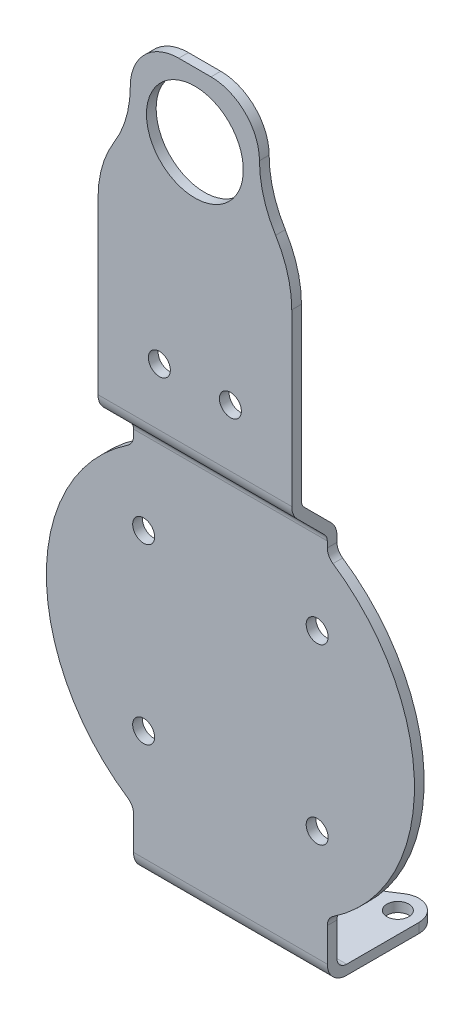
from build123d import *

# Parameters (mm, degrees)
EXTRUDE_1_DEPTH             = 30
EXTRUDE_2_DEPTH             = 14.177345132
SKETCH_3_W                  = 30
SKETCH_3_H                  = 14.177345132
EXTRUDE_3_DEPTH             = 7.766758368
EXTRUDE_4_DEPTH             = 1.5
CUT_EXTRUDE_START           = -0.577345132
CUT_EXTRUDE_1_DEPTH         = 0.577345132
CUT_EXTRUDE_START_2         = -12.1
CUT_EXTRUDE_2_DEPTH         = 12.1
SKETCH_7_W                  = 30
SKETCH_7_H                  = 7
EXTRUDE_5_DEPTH             = 52.621320344
CUT_EXTRUDE_3_DEPTH         = 97.803565652
CUT_EXTRUDE_4_DEPTH         = 93.536010044
CUT_EXTRUDE_5_DEPTH         = 93.536010044
HOLE_WIZARD_3_4_3_4_1_D     = 3.4
HOLE_WIZARD_3_4_3_4_2_D     = 3.4
HOLE_WIZARD_15_0_15_1_D     = 15
HOLE_WIZARD_3_4_3_4_3_D     = 3.4
HOLE_WIZARD_3_4_3_4_3_DEPTH = 17.427345132
FILLET_1_R                  = 1.5
FILLET_2_R                  = 2
FILLET_3_R                  = 3
FILLET_4_R                  = 7.5


with BuildPart() as part:
    # 草图1 → 凸台-拉伸1 (new body)
    with BuildSketch(Plane(origin=(15, 0, 0), x_dir=(0, 0, -1), z_dir=(1, 0, 0))):
        Polygon((-7, 32.378679656), (-1.5, 26.878679656), (-1.5, 32.378679656), align=None)
    extrude(amount=-EXTRUDE_1_DEPTH)

    # 草图2 → 凸台-拉伸2 (add)
    with BuildSketch(Plane(origin=(0, 0, 1.5), x_dir=(-1, 0, 0), z_dir=(0, 0, -1))):
        with BuildLine():
            Line((-15, 24.233241632), (-15, 32.378679656))
            Line((-15, 32.378679656), (15, 32.378679656))
            Line((15, 32.378679656), (15, 24.233241632))
            ThreePointArc((15, 24.233241632), (28.5, 0), (15, -24.233241632))
            Line((15, -24.233241632), (-15, -24.233241632))
            ThreePointArc((-15, -24.233241632), (-28.5, 0), (-15, 24.233241632))
        make_face()
    extrude(amount=EXTRUDE_2_DEPTH)

    # 草图3 → 凸台-拉伸3 (add)
    with BuildSketch(Plane.XZ.offset(24.233241632)):
        with Locations((0, -5.588672566)):
            Rectangle(SKETCH_3_W, SKETCH_3_H)
    extrude(amount=EXTRUDE_3_DEPTH)

    # 草图4 → 凸台-拉伸4 (add)
    with BuildSketch(Plane.XZ.offset(32)):
        with BuildLine():
            Line((15, 1.5), (15, -12.677345132))
            ThreePointArc((15, -12.677345132), (13.223342916, -15.57419871), (9.835839599, -15.303842792))
            ThreePointArc((9.835839599, -15.303842792), (0, -12.1), (-9.835839599, -15.303842792))
            ThreePointArc((-9.835839599, -15.303842792), (-13.223342916, -15.57419871), (-15, -12.677345132))
            Line((-15, -12.677345132), (-15, 1.5))
            Line((-15, 1.5), (15, 1.5))
        make_face()
    extrude(amount=EXTRUDE_4_DEPTH)

    # 草图5 → 切除-拉伸1 (cut)
    with BuildSketch(Plane(origin=(0, 0, -12.677345132), x_dir=(-1, 0, 0), z_dir=(0, 0, -1)).offset(CUT_EXTRUDE_START)):
        with BuildLine():
            Line((15, 24.233241632), (15, 32.378679656))
            Line((15, 32.378679656), (-15, 32.378679656))
            Line((-15, 32.378679656), (-15, 24.233241632))
            ThreePointArc((-15, 24.233241632), (-28.5, 0), (-15, -24.233241632))
            Line((-15, -24.233241632), (-15, -32))
            Line((-15, -32), (0, -32))
            Line((0, -32), (15, -32))
            Line((15, -32), (15, -24.233241632))
            ThreePointArc((15, -24.233241632), (28.5, 0), (15, 24.233241632))
        make_face()
    extrude(amount=CUT_EXTRUDE_1_DEPTH, mode=Mode.SUBTRACT)

    # 草图6 → 切除-拉伸2 (cut)
    with BuildSketch(Plane(origin=(0, 0, -12.1), x_dir=(-1, 0, 0), z_dir=(0, 0, -1)).offset(CUT_EXTRUDE_START_2)):
        with BuildLine():
            Line((15, 24.233241632), (15, 32.378679656))
            Line((15, 32.378679656), (-15, 32.378679656))
            Line((-15, 32.378679656), (-15, 24.233241632))
            ThreePointArc((-15, 24.233241632), (-28.5, 0), (-15, -24.233241632))
            Line((-15, -24.233241632), (-15, -32))
            Line((-15, -32), (15, -32))
            Line((15, -32), (15, -24.233241632))
            ThreePointArc((15, -24.233241632), (28.5, 0), (15, 24.233241632))
        make_face()
    extrude(amount=CUT_EXTRUDE_2_DEPTH, mode=Mode.SUBTRACT)

    # 草图7 → 凸台-拉伸5 (add)
    with BuildSketch(Plane(origin=(0, 32.378679656, 0), x_dir=(-1, 0, 0), z_dir=(0, 1, 0))):
        with Locations((0, 3.5)):
            Rectangle(SKETCH_7_W, SKETCH_7_H)
    extrude(amount=EXTRUDE_5_DEPTH)

    # 草图8 → 切除-拉伸3 (cut, through all)
    with BuildSketch(Plane.ZY.offset(15)):
        Polygon((0, 27.5), (5.5, 33), (5.5, 85), (0, 85), align=None)
    extrude(amount=-CUT_EXTRUDE_3_DEPTH, mode=Mode.SUBTRACT)

    # 草图9 → 切除-拉伸4 (cut, through all)
    with BuildSketch(Plane.XY.offset(7)):
        with BuildLine():
            Line((-11.795428312, 85), (-15, 85))
            Line((-15, 85), (-15, 60))
            ThreePointArc((-15, 60), (-14.362740383, 64.550068681), (-12.5, 68.75))
            ThreePointArc((-12.5, 68.75), (-10.015546325, 76.782552918), (-11.795428312, 85))
        make_face()
    extrude(amount=-CUT_EXTRUDE_4_DEPTH, mode=Mode.SUBTRACT)

    # 草图10 → 切除-拉伸5 (cut, through all)
    with BuildSketch(Plane.XY.offset(7)):
        with BuildLine():
            Line((15, 60), (15, 85))
            Line((15, 85), (11.795428312, 85))
            ThreePointArc((11.795428312, 85), (10.015546325, 76.782552918), (12.5, 68.75))
            ThreePointArc((12.5, 68.75), (14.362740383, 64.550068681), (15, 60))
        make_face()
    extrude(amount=-CUT_EXTRUDE_5_DEPTH, mode=Mode.SUBTRACT)

    # Ø3.4 (3.4) 直径孔1 (through all)
    with Locations(Plane(origin=(0, 0, 5.5), x_dir=(-1, 0, 0), z_dir=(0, 0, -1))):
        with Locations((5.5, 42.5), (-5.5, 42.5)):
            Hole(HOLE_WIZARD_3_4_3_4_1_D / 2)

    # Ø3.4 (3.4) 直径孔2 (through all)
    with Locations(Plane(origin=(0, -32, 0), x_dir=(1, 0, 0), z_dir=(0, 1, 0))):
        with Locations((-11.75, 12.677345132), (0, 8.85), (11.75, 12.677345132)):
            Hole(HOLE_WIZARD_3_4_3_4_2_D / 2)

    # Ø15.0 (15) 直径孔1 (through all)
    with Locations(Plane(origin=(0, 0, 5.5), x_dir=(-1, 0, 0), z_dir=(0, 0, -1))):
        with Locations((0, 75)):
            Hole(HOLE_WIZARD_15_0_15_1_D / 2)

    # Ø3.4 (3.4) 直径孔3
    with Locations(Plane.XY.offset(1.5)):
        with Locations((-13.435028843, -13.435028843), (-13.435028843, 13.435028843), (13.435028843, -13.435028843), (13.435028843, 13.435028843)):
            Hole(HOLE_WIZARD_3_4_3_4_3_D / 2, depth=HOLE_WIZARD_3_4_3_4_3_DEPTH)

    # 圆角1
    fillet_1_edges = [part.edges().sort_by_distance(p)[0] for p in [
        (0, -32, 0),
        (0, 33, 5.5),
        (0, 26.878679656, 1.5),
    ]]
    fillet(fillet_1_edges, radius=FILLET_1_R)

    # 圆角2
    fillet_2_edges = [part.edges().sort_by_distance(p)[0] for p in [
        (-15, -24.233241632, 0.75),
        (15, -24.233241632, 0.75),
        (-15, 24.233241632, 0.75),
        (15, 24.233241632, 0.75),
    ]]
    fillet(fillet_2_edges, radius=FILLET_2_R)

    # 圆角3
    fillet_3_edges = [part.edges().sort_by_distance(p)[0] for p in [
        (0, 27.5, 0),
        (0, -33.5, 1.5),
        (0, 32.378679656, 7),
    ]]
    fillet(fillet_3_edges, radius=FILLET_3_R)

    # 圆角4
    fillet_4_edges = [part.edges().sort_by_distance(p)[0] for p in [
        (-11.795428312, 85, 6.25),
        (11.795428312, 85, 6.25),
    ]]
    fillet(fillet_4_edges, radius=FILLET_4_R)


solid = part.part
